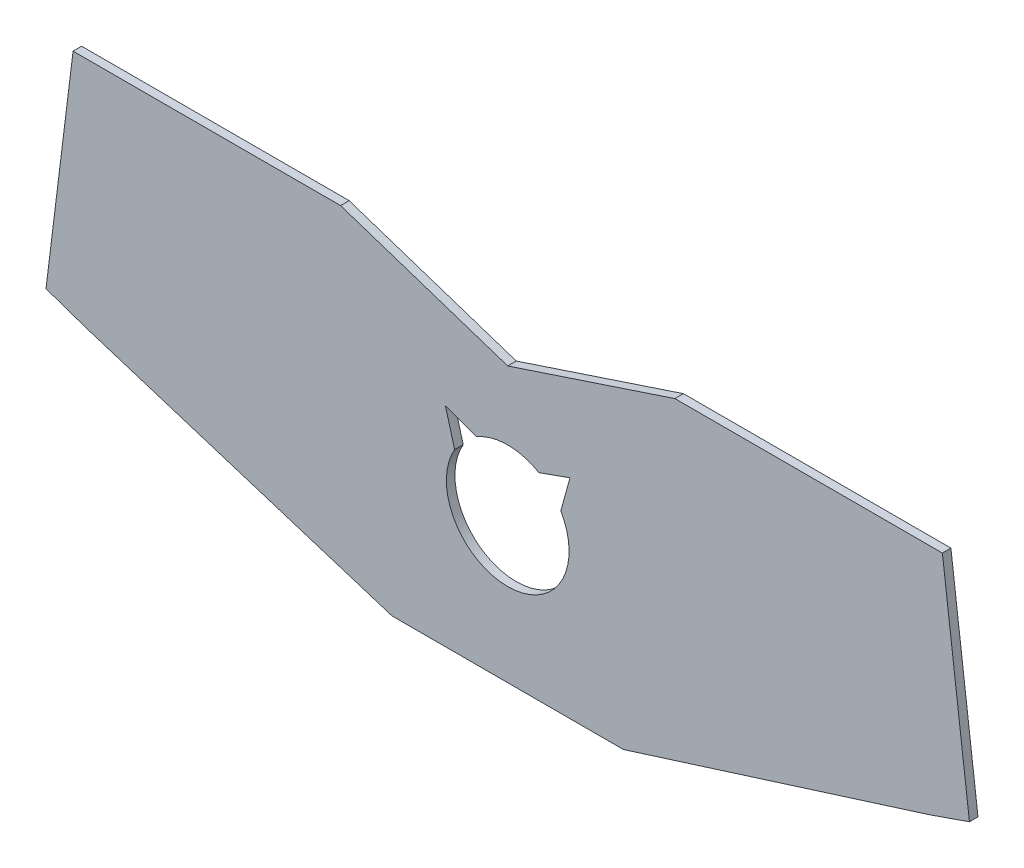
from build123d import *

# Parameters (mm, degrees)
EXTRUDE_1_DEPTH = 3


with BuildPart() as part:
    # Sketch 273 → Бобышка-Вытянуть1 (new body)
    with BuildSketch(Plane.XY):
        Polygon((148.354716995, -23.671565122), (40.597138959, -57.662313559), (-40.597138959, -57.662313559), (-148.354716995, -23.671565122), (-162, -18.92), (-152.5, 58), (-58.64, 58), (0, 38.59), (58.64, 58), (152.5, 58), (162, -18.92), align=None)
        with BuildLine():
            Line((-10.908195141, 11.626317085), (-21.848195141, 15.513282482))
            Line((-21.848195141, 15.513282482), (-18.617591482, 3.873282482))
            ThreePointArc((-18.617591482, 3.873282482), (0, -28.455), (18.617591482, 3.873282482))
            Line((18.617591482, 3.873282482), (21.848195141, 15.513282482))
            Line((21.848195141, 15.513282482), (10.908195141, 11.626317085))
            ThreePointArc((10.908195141, 11.626317085), (0, 14.595), (-10.908195141, 11.626317085))
        make_face(mode=Mode.SUBTRACT)
    extrude(amount=EXTRUDE_1_DEPTH)


solid = part.part
